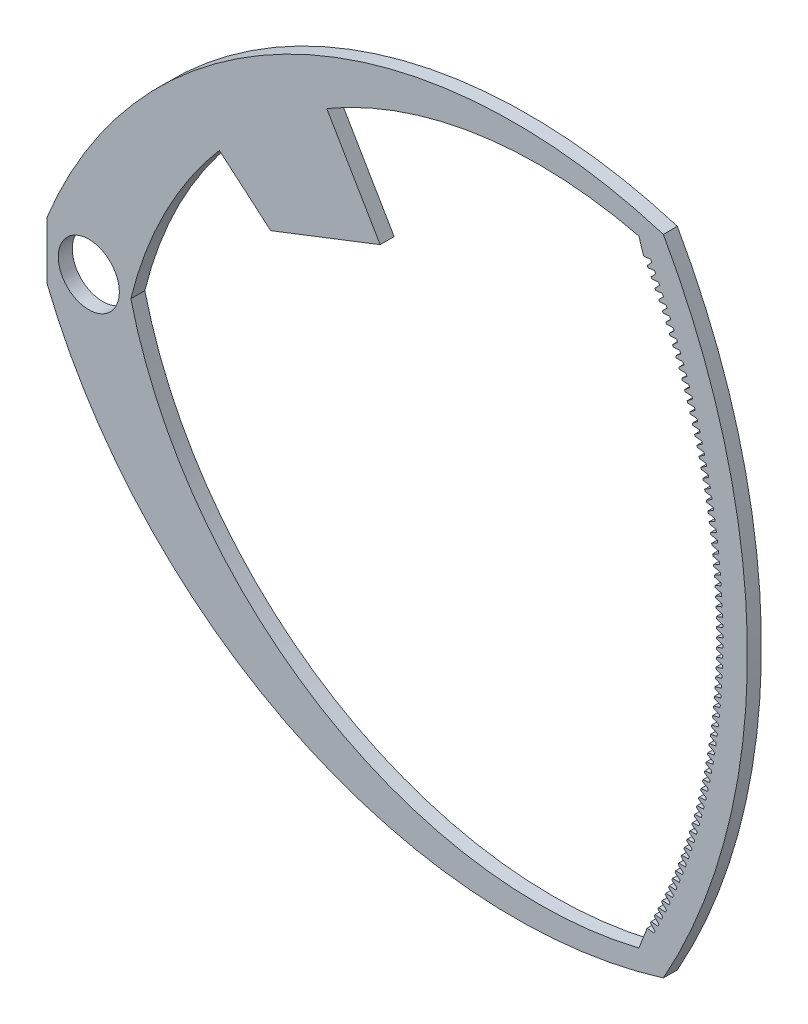
from build123d import *

# Parameters (mm, degrees)
SKETCH3_R           = 10.9
BOSS_EXTRUDE2_DEPTH = 5


with BuildPart() as part:
    # Sketch3 → Boss-Extrude2 (new body)
    with BuildSketch(Plane.XY):
        with BuildLine():
            Line((-15, -10), (-15, 10))
            ThreePointArc((-15, 10), (74.547676937, 105.343973254), (205.001324898, 114.888888889))
            ThreePointArc((205.001324898, 114.888888889), (235, 0), (205.001324898, -114.888888889))
            ThreePointArc((205.001324898, -114.888888889), (74.547676937, -105.343973254), (-15, -10))
        make_face()
        Circle(SKETCH3_R, mode=Mode.SUBTRACT)
        with BuildLine():
            Line((226.243549939, 1.708394294), (223.986030517, 2.501626139))
            ThreePointArc((223.986030517, 2.501626139), (223.982316577, 2.814580015), (223.978165378, 3.127528396))
            Line((223.978165378, 3.127528396), (226.215039475, 3.977237155))
            ThreePointArc((226.215039475, 3.977237155), (226.20677915, 4.422167637), (226.197643715, 4.867081011))
            Line((226.197643715, 4.867081011), (223.929269101, 5.628715642))
            ThreePointArc((223.929269101, 5.628715642), (223.921186005, 5.941587157), (223.912665769, 6.254447074))
            Line((223.912665769, 6.254447074), (226.137458037, 7.135304647))
            ThreePointArc((226.137458037, 7.135304647), (226.122986318, 7.580076426), (226.107639813, 8.024818881))
            Line((226.107639813, 8.024818881), (223.828852231, 8.754707815))
            ThreePointArc((223.828852231, 8.754707815), (223.816401555, 9.067435976), (223.803513942, 9.380146435))
            Line((223.803513942, 9.380146435), (226.015790654, 10.291981097))
            ThreePointArc((226.015790654, 10.291981097), (225.995110362, 10.736507465), (225.973555779, 11.180992297))
            Line((225.973555779, 11.180992297), (223.684799483, 11.878993241))
            ThreePointArc((223.684799483, 11.878993241), (223.667983653, 12.19151708), (223.650731177, 12.504017118))
            Line((223.650731177, 12.504017118), (225.850061045, 13.446651104))
            ThreePointArc((225.850061045, 13.446651104), (225.823176211, 13.8908454), (225.795417752, 14.334985957))
            Line((225.795417752, 14.334985957), (223.497138939, 15.000962834))
            ThreePointArc((223.497138939, 15.000962834), (223.475961234, 15.313221424), (223.454347258, 15.625450119))
            Line((223.454347258, 15.625450119), (225.640301519, 16.59869966))
            ThreePointArc((225.640301519, 16.59869966), (225.607217385, 17.042475287), (225.57326046, 17.486184982))
            Line((225.57326046, 17.486184982), (223.265907186, 18.12000796))
            ThreePointArc((223.265907186, 18.12000796), (223.240371735, 18.431940425), (223.214400472, 18.743836906))
            Line((223.214400472, 18.743836906), (225.386552969, 19.747512267))
            ThreePointArc((225.386552969, 19.747512267), (225.347275984, 20.19078271), (225.307127215, 20.633975041))
            Line((225.307127215, 20.633975041), (222.991149302, 21.235520554))
            ThreePointArc((222.991149302, 21.235520554), (222.961261082, 21.547066082), (222.930937596, 21.858569546))
            Line((222.930937596, 21.858569546), (225.088864864, 22.892475057))
            ThreePointArc((225.088864864, 22.892475057), (225.043402686, 23.335153899), (224.997069899, 23.777742466))
            Line((224.997069899, 23.777742466), (222.672918851, 24.346893241))
            ThreePointArc((222.672918851, 24.346893241), (222.63868369, 24.657991096), (222.604013892, 24.969040814))
            Line((222.604013892, 24.969040814), (224.747295239, 26.032974914))
            ThreePointArc((224.747295239, 26.032974914), (224.69565673, 26.474975854), (224.643148959, 26.916874373))
            Line((224.643148959, 26.916874373), (222.311277873, 27.453519453))
            ThreePointArc((222.311277873, 27.453519453), (222.272702445, 27.764108986), (222.233693094, 28.074644318))
            Line((222.233693094, 28.074644318), (224.361910683, 29.168399591))
            ThreePointArc((224.361910683, 29.168399591), (224.304105911, 29.609636461), (224.245433391, 30.050758781))
            Line((224.245433391, 30.050758781), (221.906296872, 30.554793547))
            ThreePointArc((221.906296872, 30.554793547), (221.863388696, 30.864814208), (221.820047398, 31.174774615))
            Line((221.820047398, 31.174774615), (223.932786328, 32.298137831))
            ThreePointArc((223.932786328, 32.298137831), (223.868826562, 32.738524609), (223.804000732, 33.178784735))
            Line((223.804000732, 33.178784735), (221.458054798, 33.650110924))
            ThreePointArc((221.458054798, 33.650110924), (221.410822241, 33.959502274), (221.363157444, 34.268827328))
            Line((221.363157444, 34.268827328), (223.460005833, 35.421579484))
            ThreePointArc((223.460005833, 35.421579484), (223.389903542, 35.861030318), (223.318937039, 36.300342419))
            Line((223.318937039, 36.300342419), (220.966639037, 36.738868144))
            ThreePointArc((220.966639037, 36.738868144), (220.915091307, 37.047569867), (220.863112304, 37.356199264))
            Line((220.863112304, 37.356199264), (222.943661367, 38.538115631))
            ThreePointArc((222.943661367, 38.538115631), (222.867430217, 38.976544848), (222.790336877, 39.414823279))
            Line((222.790336877, 39.414823279), (220.432145393, 39.82046305))
            ThreePointArc((220.432145393, 39.82046305), (220.376292538, 40.128414963), (220.320009462, 40.436288536))
            Line((220.320009462, 40.436288536), (222.383853592, 41.647138695))
            ThreePointArc((222.383853592, 41.647138695), (222.301508446, 42.084460823), (222.218303298, 42.521620142))
            Line((222.218303298, 42.521620142), (219.854678065, 42.894294877))
            ThreePointArc((219.854678065, 42.894294877), (219.794530974, 43.201436944), (219.733954798, 43.508494673))
            Line((219.733954798, 43.508494673), (221.780691645, 44.748042568))
            ThreePointArc((221.780691645, 44.748042568), (221.692248554, 45.184172349), (221.60294782, 45.62012733))
            Line((221.60294782, 45.62012733), (219.234349632, 45.959764377))
            ThreePointArc((219.234349632, 45.959764377), (219.16992003, 46.266036721), (219.105062564, 46.572218743))
            Line((219.105062564, 46.572218743), (221.134293112, 47.84022272))
            ThreePointArc((221.134293112, 47.84022272), (221.03976932, 48.275075131), (220.944390408, 48.709740784))
            Line((220.944390408, 48.709740784), (218.571281028, 49.01627393))
            ThreePointArc((218.571281028, 49.01627393), (218.502581477, 49.321616841), (218.433455364, 49.626863467))
            Line((218.433455364, 49.626863467), (220.44478401, 50.923076327))
            ThreePointArc((220.44478401, 50.923076327), (220.344197945, 51.356566592), (220.24275945, 51.789858177))
            Line((220.24275945, 51.789858177), (217.865601519, 52.063227662))
            ThreePointArc((217.865601519, 52.063227662), (217.792645413, 52.367581615), (217.71926413, 52.671833335))
            Line((217.71926413, 52.671833335), (219.712298762, 53.996002379))
            ThreePointArc((219.712298762, 53.996002379), (219.605670031, 54.428045988), (219.498191729, 54.859879036))
            Line((219.498191729, 54.859879036), (217.11744868, 55.100031566))
            ThreePointArc((217.11744868, 55.100031566), (217.04025024, 55.403337225), (216.962628093, 55.706534725))
            Line((216.962628093, 55.706534725), (218.936980165, 57.058401803))
            ThreePointArc((218.936980165, 57.058401803), (218.824329558, 57.488914529), (218.710832401, 57.919204852))
            Line((218.710832401, 57.919204852), (216.326968364, 58.126093609))
            ThreePointArc((216.326968364, 58.126093609), (216.245542641, 58.428291844), (216.163694762, 58.730376016))
            Line((216.163694762, 58.730376016), (218.11897937, 60.109677579))
            ThreePointArc((218.11897937, 60.109677579), (218.000328847, 60.538575492), (217.880834962, 60.967239204))
            Line((217.880834962, 60.967239204), (215.494314678, 61.140823855))
            ThreePointArc((215.494314678, 61.140823855), (215.408677545, 61.441855753), (215.32261989, 61.742767703))
            Line((215.32261989, 61.742767703), (217.258455848, 63.149234854))
            ThreePointArc((217.258455848, 63.149234854), (217.133828541, 63.576434339), (217.008361224, 64.003387872))
            Line((217.008361224, 64.003387872), (214.619649947, 64.143634576))
            ThreePointArc((214.619649947, 64.143634576), (214.5298181, 64.443441449), (214.439567447, 64.743122516))
            Line((214.439567447, 64.743122516), (216.355577359, 66.17648106))
            ThreePointArc((216.355577359, 66.17648106), (216.224997564, 66.601898835), (216.093581275, 67.027058953))
            Line((216.093581275, 67.027058953), (213.70314469, 67.133940369))
            ThreePointArc((213.70314469, 67.133940369), (213.609135643, 67.432463769), (213.514709586, 67.730855528))
            Line((213.514709586, 67.730855528), (215.410519922, 69.19082603))
            ThreePointArc((215.410519922, 69.19082603), (215.274013096, 69.614379159), (215.136673454, 70.037662976))
            Line((215.136673454, 70.037662976), (212.744977582, 70.111158266))
            ThreePointArc((212.744977582, 70.111158266), (212.646809661, 70.408339997), (212.548226608, 70.705384276))
            Line((212.548226608, 70.705384276), (214.423467778, 72.191682112))
            ThreePointArc((214.423467778, 72.191682112), (214.281060532, 72.613288022), (214.137824313, 73.034613017))
            Line((214.137824313, 73.034613017), (211.745335419, 73.074707855))
            ThreePointArc((211.745335419, 73.074707855), (211.643027762, 73.370489979), (211.540306933, 73.666128869))
            Line((211.540306933, 73.666128869), (213.394613353, 75.178464283))
            ThreePointArc((213.394613353, 75.178464283), (213.246333451, 75.59804078), (213.097228578, 76.017324817))
            Line((213.097228578, 76.017324817), (210.704413084, 76.024011385))
            ThreePointArc((210.704413084, 76.024011385), (210.597985635, 76.318336239), (210.491147056, 76.612512105))
            Line((210.491147056, 76.612512105), (212.324157226, 78.150590262))
            ThreePointArc((212.324157226, 78.150590262), (212.170033575, 78.56805555), (212.015089117, 78.985216888))
            Line((212.015089117, 78.985216888), (209.622413505, 78.958493883))
            ThreePointArc((209.622413505, 78.958493883), (209.511887014, 79.251304088), (209.400951513, 79.543959579))
            Line((209.400951513, 79.543959579), (211.212308083, 81.10748063))
            ThreePointArc((211.212308083, 81.10748063), (211.05237073, 81.522753323), (210.891616894, 81.937710634))
            Line((210.891616894, 81.937710634), (208.499547622, 81.877583266))
            ThreePointArc((208.499547622, 81.877583266), (208.384943636, 82.168821739), (208.269932839, 82.459899801))
            Line((208.269932839, 82.459899801), (210.059282683, 84.048558933))
            ThreePointArc((210.059282683, 84.048558933), (209.893562807, 84.461558073), (209.727030932, 84.874230462))
            Line((209.727030932, 84.874230462), (207.336034339, 84.780710452))
            ThreePointArc((207.336034339, 84.780710452), (207.2173752, 85.070320414), (207.098311529, 85.359764302))
            Line((207.098311529, 85.359764302), (208.865305809, 86.973251803))
            ThreePointArc((208.865305809, 86.973251803), (208.693835719, 87.383896874), (208.52155827, 87.79420389))
            Line((208.52155827, 87.79420389), (206.132100485, 87.66730947))
            ThreePointArc((206.132100485, 87.66730947), (206.009409325, 87.955234463), (205.886315993, 88.242987748))
            Line((205.886315993, 88.242987748), (207.63061023, 89.880989066))
            ThreePointArc((207.63061023, 89.880989066), (207.453423354, 90.289200012), (207.275433917, 90.697061664))
            Line((207.275433917, 90.697061664), (204.887980769, 90.536817573))
            ThreePointArc((204.887980769, 90.536817573), (204.761281509, 90.823001464), (204.634182512, 91.109008049))
            Line((204.634182512, 91.109008049), (206.355436652, 92.771203851))
            ThreePointArc((206.355436652, 92.771203851), (206.172567532, 93.176901092), (205.988900808, 93.582237867))
            Line((205.988900808, 93.582237867), (203.603917736, 93.388675344))
            ThreePointArc((203.603917736, 93.388675344), (203.473235075, 93.67306234), (203.342155191, 93.957266468))
            Line((203.342155191, 93.957266468), (205.040033673, 95.643332707))
            ThreePointArc((205.040033673, 95.643332707), (204.851517961, 96.04643715), (204.662209754, 96.449170026))
            Line((204.662209754, 96.449170026), (202.280161716, 96.222326807))
            ThreePointArc((202.280161716, 96.222326807), (202.14552113, 96.504861468), (202.010485915, 96.787207732))
            Line((202.010485915, 96.787207732), (203.684657734, 98.496815705))
            ThreePointArc((203.684657734, 98.496815705), (203.490532179, 98.897248765), (203.295619397, 99.297299229))
            Line((203.295619397, 99.297299229), (200.916970777, 99.037219538))
            ThreePointArc((200.916970777, 99.037219538), (200.778398516, 99.317846782), (200.639434294, 99.598280137))
            Line((200.639434294, 99.598280137), (202.289573066, 101.331096554))
            ThreePointArc((202.289573066, 101.331096554), (202.089875516, 101.728780165), (201.889396156, 102.126070226))
            Line((201.889396156, 102.126070226), (199.514610677, 101.832804766))
            ThreePointArc((199.514610677, 101.832804766), (199.372133755, 102.111469885), (199.229267617, 102.389935661))
            Line((199.229267617, 102.389935661), (200.855051645, 104.145622705))
            ThreePointArc((200.855051645, 104.145622705), (200.649821031, 104.540479338), (200.443814177, 104.934931544))
            Line((200.443814177, 104.934931544), (198.073354808, 104.608537487))
            ThreePointArc((198.073354808, 104.608537487), (197.927001001, 104.885186154), (197.7802608, 105.161630064))
            Line((197.7802608, 105.161630064), (196.277864264, 110))
            ThreePointArc((196.277864264, 110), (139.005865204, 112.708817074), (84.901469045, 93.731623324))
            Line((84.901469045, 93.731623324), (103.95410159, 61.187676698))
            Line((103.95410159, 61.187676698), (64.904684165, 45.9883956))
            Line((64.904684165, 45.9883956), (46.56595786, 61.631956938))
            ThreePointArc((46.56595786, 61.631956938), (27.1778699, 32.662402392), (15, 0))
            ThreePointArc((15, 0), (82.870908511, -92.521260868), (196.277864264, -110))
            Line((196.277864264, -110), (199.229267617, -102.389935661))
            Line((199.229267617, -102.389935661), (201.603224316, -102.689836135))
            ThreePointArc((201.603224316, -102.689836135), (201.80481309, -102.29310785), (202.005621157, -101.895983831))
            Line((202.005621157, -101.895983831), (200.360331052, -100.158562992))
            ThreePointArc((200.360331052, -100.158562992), (200.500078382, -99.878519056), (200.639434294, -99.598280137))
            Line((200.639434294, -99.598280137), (203.017346853, -99.865005767))
            ThreePointArc((203.017346853, -99.865005767), (203.213376785, -99.465501534), (203.408620561, -99.065612506))
            Line((203.408620561, -99.065612506), (201.73923265, -97.351332862))
            ThreePointArc((201.73923265, -97.351332862), (201.875056333, -97.069365046), (202.010485915, -96.787207732))
            Line((202.010485915, -96.787207732), (204.391890756, -97.020706518))
            ThreePointArc((204.391890756, -97.020706518), (204.58232363, -96.618504222), (204.771965052, -96.215928145))
            Line((204.771965052, -96.215928145), (203.078804784, -94.525123896))
            ThreePointArc((203.078804784, -94.525123896), (203.210678342, -94.241287171), (203.342155191, -93.957266468))
            Line((203.342155191, -93.957266468), (205.726588055, -94.15749289))
            ThreePointArc((205.726588055, -94.15749289), (205.911386746, -93.752670941), (206.095388842, -93.347486298))
            Line((206.095388842, -93.347486298), (204.378786302, -91.680487071))
            ThreePointArc((204.378786302, -91.680487071), (204.506684027, -91.394836771), (204.634182512, -91.109008049))
            Line((204.634182512, -91.109008049), (207.021178548, -91.275923072))
            ThreePointArc((207.021178548, -91.275923072), (207.200307028, -90.868560391), (207.378633928, -90.460846173))
            Line((207.378633928, -90.460846173), (205.638923772, -88.817976953))
            ThreePointArc((205.638923772, -88.817976953), (205.762820728, -88.530568765), (205.886315993, -88.242987748))
            Line((205.886315993, -88.242987748), (208.275409852, -88.376558832))
            ThreePointArc((208.275409852, -88.376558832), (208.4488332, -87.966734835), (208.621450138, -87.556570527))
            Line((208.621450138, -87.556570527), (206.858971526, -85.938151594))
            ThreePointArc((206.858971526, -85.938151594), (206.97884356, -85.64904155), (207.098311529, -85.359764302))
            Line((207.098311529, -85.359764302), (209.489037452, -85.459965407))
            ThreePointArc((209.489037452, -85.459965407), (209.656721859, -85.047759989), (209.823595183, -84.635225554))
            Line((209.823595183, -84.635225554), (208.038691713, -83.041572422))
            ThreePointArc((208.038691713, -83.041572422), (208.154515456, -82.750816885), (208.269932839, -82.459899801))
            Line((208.269932839, -82.459899801), (210.66182475, -82.526711392))
            ThreePointArc((210.66182475, -82.526711392), (210.823737525, -82.112204915), (210.984834702, -81.697380776))
            Line((210.984834702, -81.697380776), (209.177854345, -80.128804131))
            ThreePointArc((209.177854345, -80.128804131), (209.289607217, -79.836459784), (209.400951513, -79.543959579))
            Line((209.400951513, -79.543959579), (211.793543107, -79.577368631))
            ThreePointArc((211.793543107, -79.577368631), (211.949652685, -79.160641903), (212.10494231, -78.743608932))
            Line((212.10494231, -78.743608932), (210.27623734, -77.200414572))
            ThreePointArc((210.27623734, -77.200414572), (210.383897555, -76.906538407), (210.491147056, -76.612512105))
            Line((210.491147056, -76.612512105), (212.883971893, -76.612512105))
            ThreePointArc((212.883971893, -76.612512105), (213.034247841, -76.193646368), (213.183699639, -75.774485865))
            Line((213.183699639, -75.774485865), (211.333626566, -74.256974638))
            ThreePointArc((211.333626566, -74.256974638), (211.437173134, -73.961623948), (211.540306933, -73.666128869))
            Line((211.540306933, -73.666128869), (213.932898527, -73.632719818))
            ThreePointArc((213.932898527, -73.632719818), (214.077311548, -73.21179673), (214.220896384, -72.790590413))
            Line((214.220896384, -72.790590413), (212.349815883, -71.29905816))
            ThreePointArc((212.349815883, -71.29905816), (212.449228618, -71.002290524), (212.548226608, -70.705384276))
            Line((212.548226608, -70.705384276), (214.940118519, -70.638572685))
            ThreePointArc((214.940118519, -70.638572685), (215.078640459, -70.215674307), (215.21633034, -69.79250429))
            Line((215.21633034, -69.79250429), (213.324607182, -68.327241789))
            ThreePointArc((213.324607182, -68.327241789), (213.419866704, -68.029115062), (213.514709586, -67.730855528))
            Line((213.514709586, -67.730855528), (215.905435509, -67.630654424))
            ThreePointArc((215.905435509, -67.630654424), (216.038039363, -67.205863199), (216.169807446, -66.78081198))
            Line((216.169807446, -66.78081198), (214.257810427, -65.342104887))
            ThreePointArc((214.257810427, -65.342104887), (214.348898164, -65.04267719), (214.439567447, -64.743122516))
            Line((214.439567447, -64.743122516), (216.828661306, -64.609551432))
            ThreePointArc((216.828661306, -64.609551432), (216.955321223, -64.182950175), (217.08114182, -63.756100619))
            Line((217.08114182, -63.756100619), (215.149243687, -62.344229413))
            ThreePointArc((215.149243687, -62.344229413), (215.236141881, -62.043559119), (215.32261989, -61.742767703))
            Line((215.32261989, -61.742767703), (217.709615926, -61.57585268))
            ThreePointArc((217.709615926, -61.57585268), (217.830307213, -61.147524558), (217.950155795, -60.71895988))
            Line((217.950155795, -60.71895988), (215.998733175, -59.334199807))
            ThreePointArc((215.998733175, -59.334199807), (216.081424886, -59.032345533), (216.163694762, -58.730376016))
            Line((216.163694762, -58.730376016), (218.548127625, -58.530149594))
            ThreePointArc((218.548127625, -58.530149594), (218.662826753, -58.10017811), (218.776679956, -57.669981859))
            Line((218.776679956, -57.669981859), (216.806113283, -56.312602882))
            ThreePointArc((216.806113283, -56.312602882), (216.884582389, -56.009623474), (216.962628093, -55.706534725))
            Line((216.962628093, -55.706534725), (219.344032934, -55.473035939))
            ThreePointArc((219.344032934, -55.473035939), (219.452717542, -55.041504917), (219.560553169, -54.609760961))
            Line((219.560553169, -54.609760961), (217.571226609, -53.280027702))
            ThreePointArc((217.571226609, -53.280027702), (217.645457814, -52.975982229), (217.71926413, -52.671833335))
            Line((217.71926413, -52.671833335), (220.097176689, -52.405107705))
            ThreePointArc((220.097176689, -52.405107705), (220.199825588, -51.972101274), (220.301622617, -51.538893781))
            Line((220.301622617, -51.538893781), (218.293923993, -50.237065476))
            ThreePointArc((218.293923993, -50.237065476), (218.363902825, -49.93201321), (218.433455364, -49.626863467))
            Line((218.433455364, -49.626863467), (220.807412063, -49.326962993))
            ThreePointArc((220.807412063, -49.326962993), (220.904005243, -48.892565566), (220.999743828, -48.457978993))
            Line((220.999743828, -48.457978993), (218.974064545, -47.184309435))
            ThreePointArc((218.974064545, -47.184309435), (219.03977736, -46.878309847), (219.105062564, -46.572218743))
            Line((219.105062564, -46.572218743), (221.474600595, -46.239201891))
            ThreePointArc((221.474600595, -46.239201891), (221.565119224, -45.803498156), (221.6547807, -45.367617225))
            Line((221.6547807, -45.367617225), (219.611515668, -44.122354719))
            ThreePointArc((219.611515668, -44.122354719), (219.672949657, -43.815467465), (219.733954798, -43.508494673))
            Line((219.733954798, -43.508494673), (222.098612214, -43.142426364))
            ThreePointArc((222.098612214, -43.142426364), (222.183038646, -42.705501263), (222.266605534, -42.26841095))
            Line((222.266605534, -42.26841095), (220.206153092, -41.051798262))
            ThreePointArc((220.206153092, -41.051798262), (220.263296277, -40.74408317), (220.320009462, -40.436288536))
            Line((220.320009462, -40.436288536), (222.679325269, -40.037240137))
            ThreePointArc((222.679325269, -40.037240137), (222.757643044, -39.599178848), (222.835099053, -39.160964365))
            Line((222.835099053, -39.160964365), (220.757860889, -37.973238676))
            ThreePointArc((220.757860889, -37.973238676), (220.810702131, -37.664755735), (220.863112304, -37.356199264))
            Line((220.863112304, -37.356199264), (223.216626548, -36.92424857))
            ThreePointArc((223.216626548, -36.92424857), (223.288820398, -36.485136495), (223.360150428, -36.045883273))
            Line((223.360150428, -36.045883273), (221.266531505, -34.887276132))
            ThreePointArc((221.266531505, -34.887276132), (221.315060501, -34.578085482), (221.363157444, -34.268827328))
            Line((221.363157444, -34.268827328), (223.710411304, -33.804058548))
            ThreePointArc((223.710411304, -33.804058548), (223.776467155, -33.363981292), (223.841657299, -32.923774964))
            Line((223.841657299, -32.923774964), (221.732065771, -31.794512245))
            ThreePointArc((221.732065771, -31.794512245), (221.776273061, -31.484674162), (221.820047398, -31.174774615))
            Line((221.820047398, -31.174774615), (224.160583271, -30.677278357))
            ThreePointArc((224.160583271, -30.677278357), (224.220488246, -30.236321715), (224.279525795, -29.795248099))
            Line((224.279525795, -29.795248099), (222.154372932, -28.695549954))
            ThreePointArc((222.154372932, -28.695549954), (222.194249898, -28.385124843), (222.233693094, -28.074644318))
            Line((222.233693094, -28.074644318), (224.567054689, -27.544517571))
            ThreePointArc((224.567054689, -27.544517571), (224.620797108, -27.102767507), (224.673670553, -26.660912592))
            Line((224.673670553, -26.660912592), (222.533370658, -25.590993409))
            ThreePointArc((222.533370658, -25.590993409), (222.568909525, -25.280041787), (222.604013892, -24.969040814))
            Line((222.604013892, -24.969040814), (224.929746315, -24.406386926))
            ThreePointArc((224.929746315, -24.406386926), (224.977315701, -23.963929561), (225.024014734, -23.521379488))
            Line((225.024014734, -23.521379488), (222.868985062, -22.481447849))
            ThreePointArc((222.868985062, -22.481447849), (222.900178903, -22.170030338), (222.930937596, -21.858569546))
            Line((222.930937596, -21.858569546), (225.248587441, -21.263498207))
            ThreePointArc((225.248587441, -21.263498207), (225.28997452, -20.820419799), (225.330490037, -20.377260844))
            Line((225.330490037, -20.377260844), (223.161150716, -19.367519486))
            ThreePointArc((223.161150716, -19.367519486), (223.187993449, -19.055696796), (223.214400472, -18.743836906))
            Line((223.214400472, -18.743836906), (225.523515908, -18.116464128))
            ThreePointArc((225.523515908, -18.116464128), (225.558712613, -17.672851055), (225.593036715, -17.229169612))
            Line((225.593036715, -17.229169612), (223.409810662, -16.249815387))
            ThreePointArc((223.409810662, -16.249815387), (223.432297053, -15.937648309), (223.454347258, -15.625450119))
            Line((223.454347258, -15.625450119), (225.754478119, -14.965898208))
            ThreePointArc((225.754478119, -14.965898208), (225.783477587, -14.521836954), (225.811603584, -14.07771952))
            Line((225.811603584, -14.07771952), (223.614916422, -13.128943354))
            ThreePointArc((223.614916422, -13.128943354), (223.633042088, -12.816492746), (223.650731177, -12.504017118))
            Line((223.650731177, -12.504017118), (225.941429047, -11.812414656))
            ThreePointArc((225.941429047, -11.812414656), (225.964225626, -11.367991791), (225.986148033, -10.923524948))
            Line((225.986148033, -10.923524948), (223.776428011, -10.005511807))
            ThreePointArc((223.776428011, -10.005511807), (223.790189419, -9.692838583), (223.803513942, -9.380146435))
            Line((223.803513942, -9.380146435), (226.084332246, -8.656628251))
            ThreePointArc((226.084332246, -8.656628251), (226.10092149, -8.211930417), (226.116636034, -7.767200814))
            Line((226.116636034, -7.767200814), (223.894313942, -6.880129667))
            ThreePointArc((223.894313942, -6.880129667), (223.903708409, -6.567294781), (223.912665769, -6.254447074))
            Line((223.912665769, -6.254447074), (226.183159857, -5.499154219))
            ThreePointArc((226.183159857, -5.499154219), (226.193538533, -5.05426811), (226.20304215, -4.609362448))
            Line((226.20304215, -4.609362448), (223.968551234, -3.753406231))
            ThreePointArc((223.968551234, -3.753406231), (223.973576927, -3.440470672), (223.978165378, -3.127528396))
            Line((223.978165378, -3.127528396), (226.237892612, -2.340608116))
            ThreePointArc((226.237892612, -2.340608116), (226.242058696, -1.895620464), (226.245349534, -1.450625479))
            Line((226.245349534, -1.450625479), (223.999125412, -0.625951061))
            ThreePointArc((223.999125412, -0.625951061), (223.999781353, -0.312975836), (224, 0))
            Line((224, 0), (226.248519842, 0.818394294))
            ThreePointArc((226.248519842, 0.818394294), (226.246472522, 1.263396738), (226.243549939, 1.708394294))
        make_face(mode=Mode.SUBTRACT)
    extrude(amount=BOSS_EXTRUDE2_DEPTH)


solid = part.part
